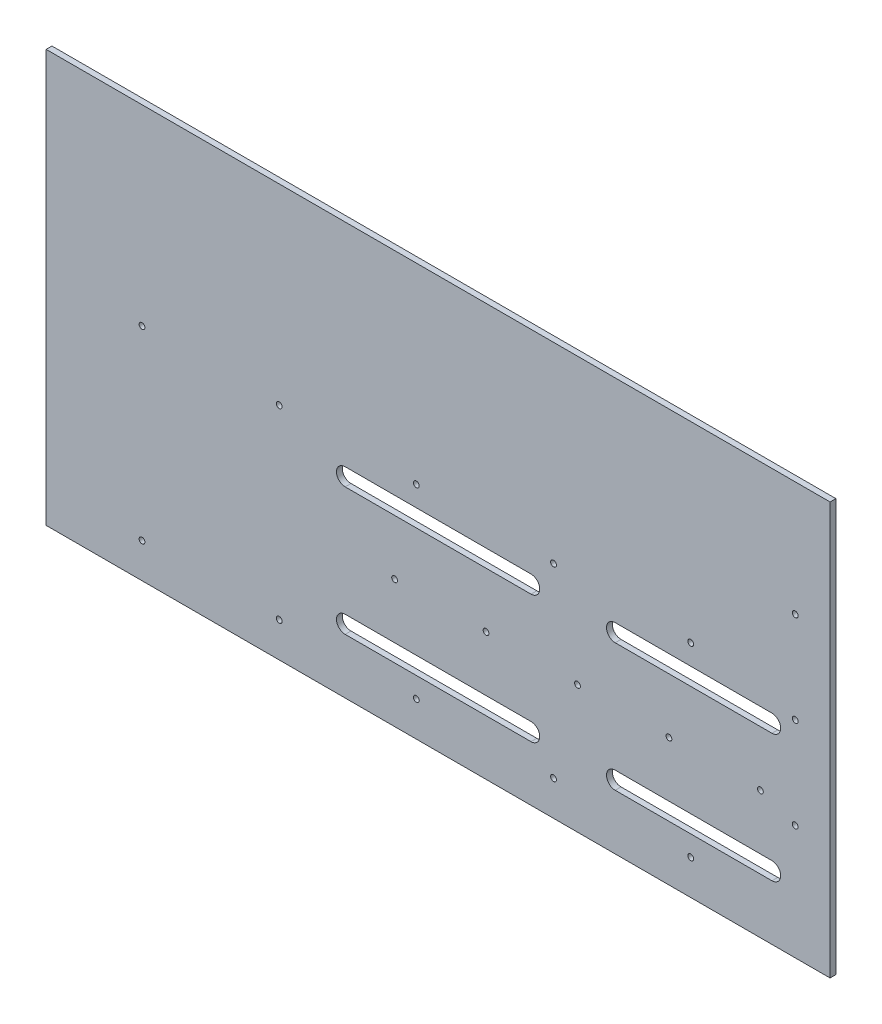
from build123d import *

# Parameters (mm, degrees)
SKETCH1_W           = 857.25
SKETCH1_H           = 450.85
BOSS_EXTRUDE1_DEPTH = 6.35
SKETCH2_R           = 3.175
CUT_EXTRUDE1_DEPTH  = 485.330614095
SKETCH3_R           = 3.175
CUT_EXTRUDE2_DEPTH  = 485.330614095


with BuildPart() as part:
    # Sketch1 → Boss-Extrude1 (new body)
    with BuildSketch(Plane.XY):
        Rectangle(SKETCH1_W, SKETCH1_H)
    extrude(amount=BOSS_EXTRUDE1_DEPTH)

    # Sketch2 → Cut-Extrude1 (cut, through all)
    with BuildSketch(Plane.XY.offset(6.35)):
        with Locations((352.425, -85.725)):
            Circle(SKETCH2_R)
        with Locations((252.425000102, -85.725)):
            Circle(SKETCH2_R)
        with Locations((152.425000204, -85.725)):
            Circle(SKETCH2_R)
        with Locations((52.425000306, -85.725)):
            Circle(SKETCH2_R)
        with Locations((-47.574999592, -85.725)):
            Circle(SKETCH2_R)
        with Locations((276.225, -187.325)):
            Circle(SKETCH2_R)
        with Locations((126.225000026, -187.325)):
            Circle(SKETCH2_R)
        with Locations((-23.774999948, -187.325)):
            Circle(SKETCH2_R)
        with Locations((-173.774999922, -187.325)):
            Circle(SKETCH2_R)
        with Locations((-323.774999896, -187.325)):
            Circle(SKETCH2_R)
        with Locations((276.225, 15.875)):
            Circle(SKETCH2_R)
        with Locations((126.225000026, 15.875)):
            Circle(SKETCH2_R)
        with Locations((-23.774999948, 15.875)):
            Circle(SKETCH2_R)
        with Locations((-173.774999922, 15.875)):
            Circle(SKETCH2_R)
        with Locations((-323.774999896, 15.875)):
            Circle(SKETCH2_R)
        with BuildLine():
            Line((-101.6, -146.05), (101.6, -146.05))
            ThreePointArc((101.6, -146.05), (111.125, -155.575), (101.6, -165.1))
            Line((101.6, -165.1), (-101.6, -165.1))
            ThreePointArc((-101.6, -165.1), (-111.125, -155.575), (-101.6, -146.05))
        make_face()
        with BuildLine():
            Line((193.675, -146.05), (365.125, -146.05))
            ThreePointArc((365.125, -146.05), (374.65, -155.575), (365.125, -165.1))
            Line((365.125, -165.1), (193.675, -165.1))
            ThreePointArc((193.675, -165.1), (184.15, -155.575), (193.675, -146.05))
        make_face()
        with BuildLine():
            Line((365.125, -25.4), (193.675, -25.4))
            ThreePointArc((193.675, -25.4), (184.15, -15.875), (193.675, -6.35))
            Line((193.675, -6.35), (365.125, -6.35))
            ThreePointArc((365.125, -6.35), (374.65, -15.875), (365.125, -25.4))
        make_face()
        with BuildLine():
            Line((101.6, -25.4), (-101.6, -25.4))
            ThreePointArc((-101.6, -25.4), (-111.125, -15.875), (-101.6, -6.35))
            Line((-101.6, -6.35), (101.6, -6.35))
            ThreePointArc((101.6, -6.35), (111.125, -15.875), (101.6, -25.4))
        make_face()
    extrude(amount=-CUT_EXTRUDE1_DEPTH, mode=Mode.SUBTRACT)

    # Sketch3 → Cut-Extrude2 (cut, through all)
    with BuildSketch(Plane.XY.offset(6.35)):
        with Locations((390.525, -100.000000152)):
            Circle(SKETCH3_R)
        with Locations((390.525, 0)):
            Circle(SKETCH3_R)
        with Locations((390.525, 100.000000152)):
            Circle(SKETCH3_R)
    extrude(amount=-CUT_EXTRUDE2_DEPTH, mode=Mode.SUBTRACT)


solid = part.part
